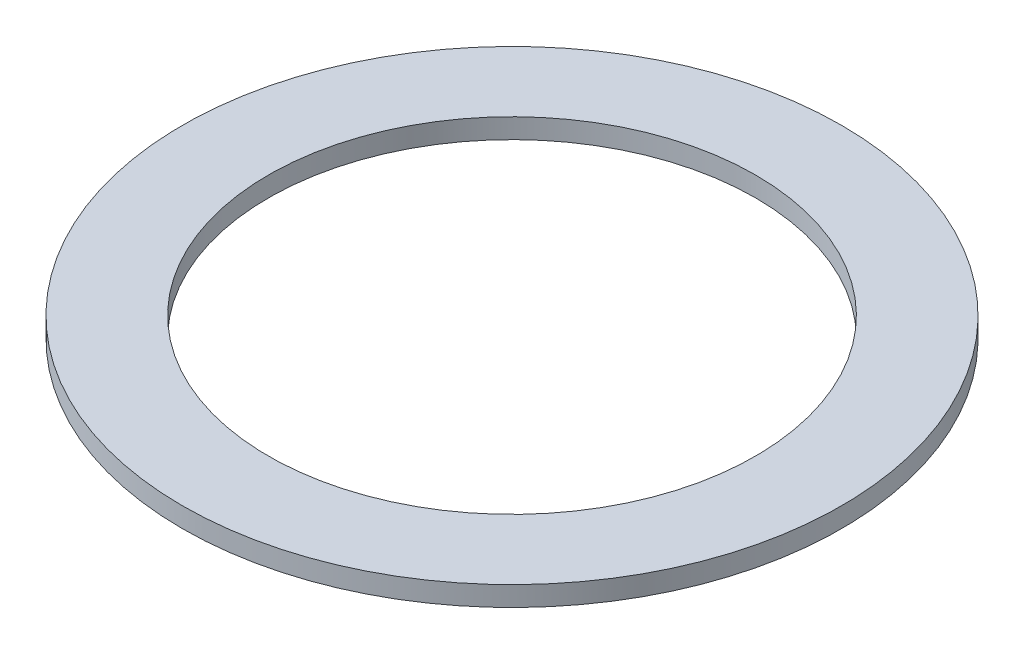
from build123d import *

# Parameters (mm, degrees)
SKETCH1_W = 6.5
SKETCH1_H = 1.5


with BuildPart() as part:
    # Sketch1 → Revolve1 (revolve)
    with BuildSketch(Plane.XY, mode=Mode.PRIVATE) as revolve1_sk:
        with Locations((-21.65, 0.75)):
            Rectangle(SKETCH1_W, SKETCH1_H)
    revolve(revolve1_sk.sketch.rotate(Axis((0, 0, 0), (0, 1, 0)), 270), axis=Axis((0, 0, 0), (0, 1, 0)))


solid = part.part
